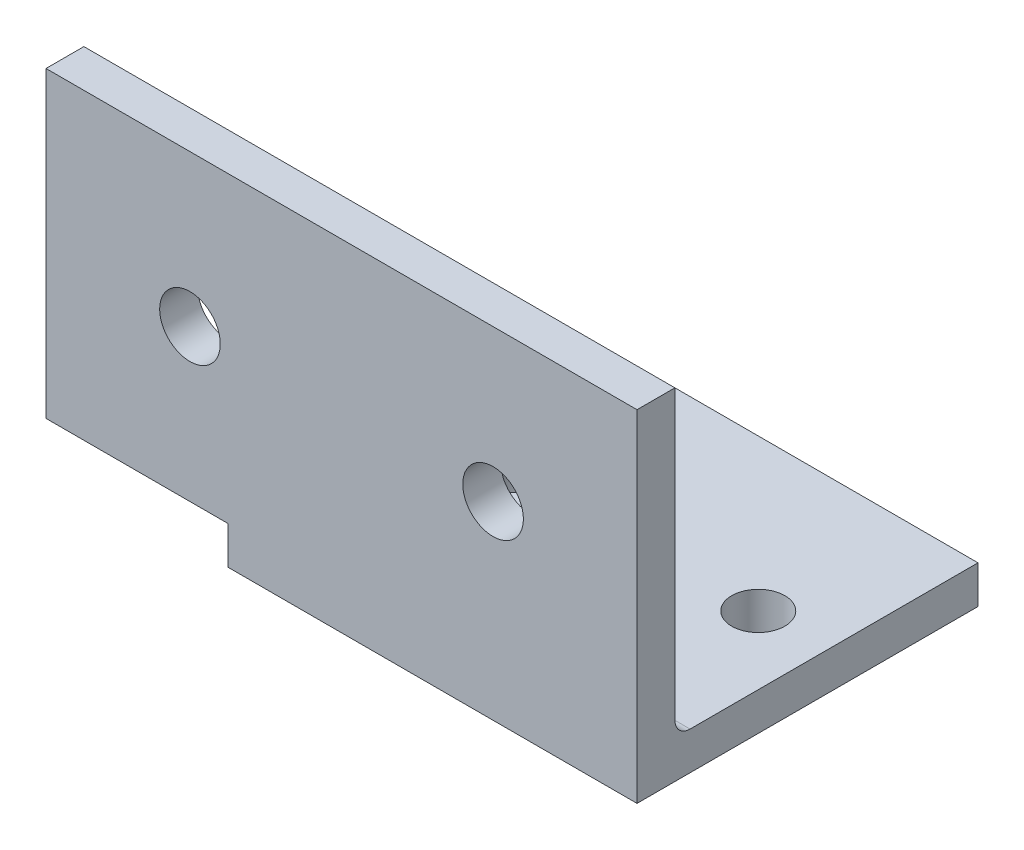
from build123d import *

# Parameters (mm, degrees)
SKETCH1_W           = 49.53
SKETCH1_H           = 28.575
SKETCH1_R           = 2.2225
BOSS_EXTRUDE1_DEPTH = 3.175
SKETCH2_W           = 49.53
SKETCH2_H           = 3.175
BOSS_EXTRUDE2_DEPTH = 25.4
SKETCH4_R           = 2.54
CUT_EXTRUDE1_DEPTH  = 3.175
SKETCH5_W           = 15.24
SKETCH5_H           = 28.575
CUT_EXTRUDE2_DEPTH  = 3.175
FILLET2_R           = 1.27


with BuildPart() as part:
    # Sketch1 → Boss-Extrude1 (new body)
    with BuildSketch(Plane(origin=(0, 0, 0), x_dir=(1, 0, 0), z_dir=(0, 1, 0))):
        with Locations((24.765, 14.2875)):
            Rectangle(SKETCH1_W, SKETCH1_H)
        with Locations(Location((23.495, 15.875, 0), (0, 0, 270))):
            Circle(SKETCH1_R, mode=Mode.SUBTRACT)
        with Locations(Location((43.815, 15.875, 0), (0, 0, 270))):
            Circle(SKETCH1_R, mode=Mode.SUBTRACT)
    extrude(amount=BOSS_EXTRUDE1_DEPTH)

    # Sketch2 → Boss-Extrude2 (add)
    with BuildSketch(Plane(origin=(0, 3.175, 0), x_dir=(1, 0, 0), z_dir=(0, 1, 0))):
        with Locations((24.765, 1.5875)):
            Rectangle(SKETCH2_W, SKETCH2_H)
    extrude(amount=BOSS_EXTRUDE2_DEPTH)

    # Sketch4 → Cut-Extrude1 (cut)
    with BuildSketch(Plane(origin=(0, 0, -3.175), x_dir=(-1, 0, 0), z_dir=(0, 0, -1))):
        with Locations((-12.065, 15.875)):
            Circle(SKETCH4_R)
        with Locations((-37.465, 15.875)):
            Circle(SKETCH4_R)
    extrude(amount=-CUT_EXTRUDE1_DEPTH, mode=Mode.SUBTRACT)

    # Sketch5 → Cut-Extrude2 (cut)
    with BuildSketch(Plane.XZ):
        with Locations((7.62, -14.2875)):
            Rectangle(SKETCH5_W, SKETCH5_H)
    extrude(amount=-CUT_EXTRUDE2_DEPTH, mode=Mode.SUBTRACT)

    # Fillet2
    fillet2_edges = [part.edges().sort_by_distance(p)[0] for p in [
        (32.385, 3.175, -3.175),
    ]]
    fillet(fillet2_edges, radius=FILLET2_R)


solid = part.part
